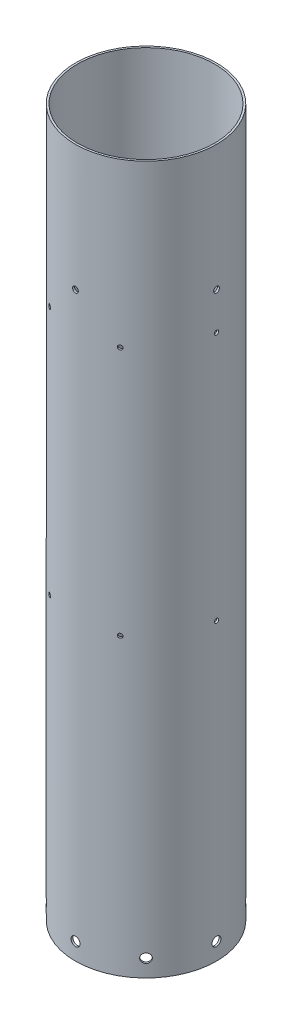
from build123d import *

# Parameters (mm, degrees)
SKETCH2_R                           = 78.359
SKETCH2_R_2                         = 76.2
BOSS_EXTRUDE1_DEPTH                 = 785.495
N2_TO_LOX_LOX_SIDE_HOLES_REACH      = 820.432
N2_TO_LOX_LOX_SIDE_HOLES_END_RADIUS = 78.359
SKETCH5_R                           = 5.0165
CIRPATTERN3_COUNT                   = 8
SKETCH7_R                           = 2.381249991
SKETCH7_R_2                         = 2.378452309
CUT_EXTRUDE2_DEPTH                  = 794.273383504
CIRPATTERN4_COUNT                   = 4
CIRPATTERN4_ANGLE                   = 180
SKETCH9_R                           = 3.175
CUT_EXTRUDE3_DEPTH                  = 794.273383505
CIRPATTERN5_COUNT                   = 3
CIRPATTERN5_ANGLE                   = 180


with BuildPart() as part:
    # Sketch2 → Boss-Extrude1 (new body)
    with BuildSketch(Plane(origin=(0, 0, 0), x_dir=(1, 0, 0), z_dir=(0, 1, 0))):
        with Locations(Location((0, 0, 0), (0, 0, 270))):
            Circle(SKETCH2_R)
        with Locations(Location((0, 0, 0), (0, 0, 270))):
            Circle(SKETCH2_R_2, mode=Mode.SUBTRACT)
    extrude(amount=BOSS_EXTRUDE1_DEPTH)

    # N2 to LOX, LOX Side Holes: up to this cylinder (the profile starts inside it)
    n2_to_lox_lox_side_holes_end = Plane(origin=(0, 19.05, 0), z_dir=(0, -1, 0)) * Cylinder(N2_TO_LOX_LOX_SIDE_HOLES_END_RADIUS, 1798.582, mode=Mode.PRIVATE)
    # Sketch5 → N2 to LOX, LOX Side Holes (cut, up to the surface)
    with BuildSketch(Plane(origin=(0, -25.4, 0), x_dir=(0, 0, 1), z_dir=(1, 0, 0)), mode=Mode.PRIVATE) as n2_to_lox_lox_side_holes_sk1:
        with Locations((0, -44.45)):
            Circle(SKETCH5_R)
    n2_to_lox_lox_side_holes_tool1 = extrude(n2_to_lox_lox_side_holes_sk1.sketch, amount=N2_TO_LOX_LOX_SIDE_HOLES_REACH, mode=Mode.PRIVATE) & n2_to_lox_lox_side_holes_end
    n2_to_lox_lox_side_holes = n2_to_lox_lox_side_holes_tool1.solids().sort_by_distance((0, 19.05, 0))[0]
    add(n2_to_lox_lox_side_holes, mode=Mode.SUBTRACT)

    # CirPattern3: N2 to LOX, LOX Side Holes ×8 about axis
    cirpattern3_axis = Axis((0, 0, 0), (0, 1, 0))
    for i in range(1, CIRPATTERN3_COUNT):
        add(n2_to_lox_lox_side_holes.rotate(cirpattern3_axis, i * 360 / CIRPATTERN3_COUNT), mode=Mode.SUBTRACT)

    # Sketch7 → Cut-Extrude2 (cut, symmetric)
    with BuildSketch(Plane(origin=(0, 0, 0), x_dir=(0, 0, -1), z_dir=(1, 0, 0))):
        with Locations((-4e-09, 604.519999983)):
            Circle(SKETCH7_R)
        with Locations((-4e-09, 327.33028923)):
            Circle(SKETCH7_R_2)
    cut_extrude2 = extrude(amount=CUT_EXTRUDE2_DEPTH, both=True, mode=Mode.SUBTRACT)

    # CirPattern4: Cut-Extrude2 ×4 about axis
    cirpattern4_axis = Axis((0, 785.495, 0), (0, -1, 0))
    for i in range(1, CIRPATTERN4_COUNT):
        add(cut_extrude2.rotate(cirpattern4_axis, i * CIRPATTERN4_ANGLE / (CIRPATTERN4_COUNT - 1)), mode=Mode.SUBTRACT)

    # Sketch9 → Cut-Extrude3 (cut, symmetric)
    with BuildSketch(Plane(origin=(0, 0, 0), x_dir=(0, 0, -1), z_dir=(1, 0, 0))):
        with Locations((0, 645.795)):
            Circle(SKETCH9_R)
    cut_extrude3 = extrude(amount=CUT_EXTRUDE3_DEPTH, both=True, mode=Mode.SUBTRACT)

    # CirPattern5: Cut-Extrude3 ×3 about axis
    cirpattern5_axis = Axis((0, 785.495, 0), (0, -1, 0))
    for i in range(1, CIRPATTERN5_COUNT):
        add(cut_extrude3.rotate(cirpattern5_axis, i * CIRPATTERN5_ANGLE / (CIRPATTERN5_COUNT - 1)), mode=Mode.SUBTRACT)


solid = part.part
